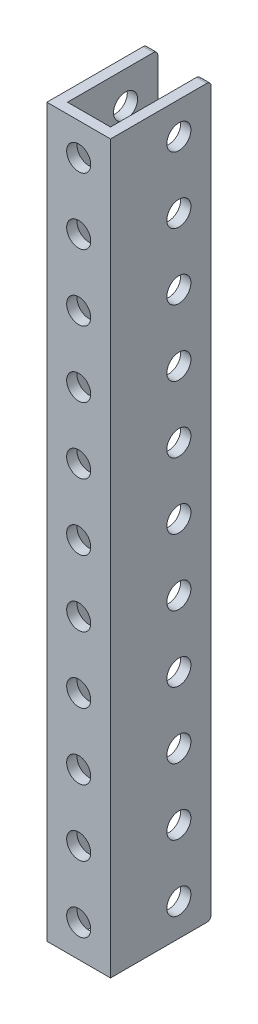
from build123d import *

# Parameters (mm, degrees)
SKETCH1_W                 = 14.859
SKETCH1_H                 = 107.315
BOSS_EXTRUDE1_DEPTH       = 9.398
SKETCH2_W                 = 6.35
SKETCH2_H                 = 13.335
CUT_EXTRUDE1_DEPTH        = 109.242376411
F_5_CLEARANCE_HOLE1_D     = 3.556
F_5_CLEARANCE_HOLE1_DEPTH = 1.524
F_5_CLEARANCE_HOLE2_D     = 3.556
F_5_CLEARANCE_HOLE2_DEPTH = 14.859
F_5_CLEARANCE_HOLE3_D     = 3.556
F_5_CLEARANCE_HOLE3_DEPTH = 9.398
FILLET1_R                 = 0.635


with BuildPart() as part:
    # Sketch1 → Boss-Extrude1 (new body)
    with BuildSketch(Plane(origin=(4.699, 0, 0), x_dir=(0, 0, -1), z_dir=(1, 0, 0))):
        with Locations((5.9055, 53.6575)):
            Rectangle(SKETCH1_W, SKETCH1_H)
    extrude(amount=-BOSS_EXTRUDE1_DEPTH)

    # Sketch2 → Cut-Extrude1 (cut, through all)
    with BuildSketch(Plane.XZ):
        with Locations((0, -6.6675)):
            Rectangle(SKETCH2_W, SKETCH2_H)
    extrude(amount=-CUT_EXTRUDE1_DEPTH, mode=Mode.SUBTRACT)

    # #5 Clearance Hole1
    with Locations(Plane(origin=(-3.175, 0, 0), x_dir=(0, 0, -1), z_dir=(1, 0, 0))):
        with Locations((8.5725, 92.7735), (8.5725, 102.5525), (8.5725, 82.9945), (8.5725, 73.2155), (8.5725, 63.4365), (8.5725, 53.6575), (8.5725, 43.8785), (8.5725, 34.0995), (8.5725, 24.3205), (8.5725, 14.5415), (8.5725, 4.7625)):
            Hole(F_5_CLEARANCE_HOLE1_D / 2, depth=F_5_CLEARANCE_HOLE1_DEPTH)

    # #5 Clearance Hole2
    with Locations(Plane.XY.offset(1.524)):
        with Locations((0, 92.7735), (0, 102.5525), (0, 82.9945), (0, 73.2155), (0, 63.4365), (0, 53.6575), (0, 43.8785), (0, 34.0995), (0, 24.3205), (0, 14.5415), (0, 4.7625)):
            Hole(F_5_CLEARANCE_HOLE2_D / 2, depth=F_5_CLEARANCE_HOLE2_DEPTH)

    # #5 Clearance Hole3
    with Locations(Plane(origin=(4.699, 0, 0), x_dir=(0, 0, -1), z_dir=(1, 0, 0))):
        with Locations((8.5725, 92.7735), (8.5725, 102.5525), (8.5725, 82.9945), (8.5725, 73.2155), (8.5725, 63.4365), (8.5725, 53.6575), (8.5725, 43.8785), (8.5725, 34.0995), (8.5725, 24.3205), (8.5725, 14.5415), (8.5725, 4.7625)):
            Hole(F_5_CLEARANCE_HOLE3_D / 2, depth=F_5_CLEARANCE_HOLE3_DEPTH)

    # Fillet1
    fillet1_edges = [part.edges().sort_by_distance(p)[0] for p in [
        (3.937, 0, -13.335),
        (3.937, 107.315, -13.335),
        (-3.937, 107.315, -13.335),
        (-3.937, 0, -13.335),
    ]]
    fillet(fillet1_edges, radius=FILLET1_R)


solid = part.part
